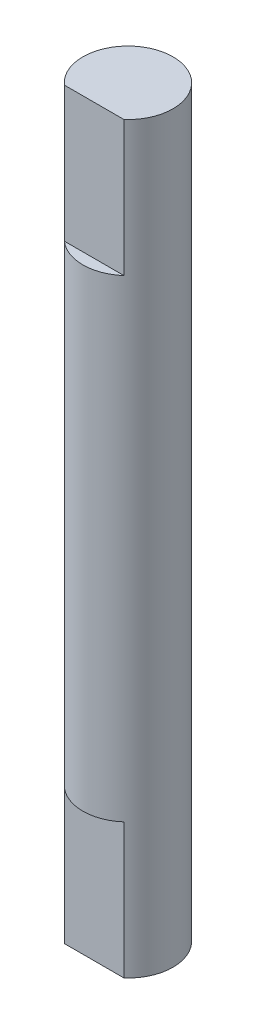
from build123d import *

# Parameters (mm, degrees)
SKETCH2_R               = 4
BOSS_EXTRUDE2_DEPTH     = 66
CUT_EXTRUDE1_START      = -12
CUT_EXTRUDE1_DEPTH      = 12
CUT_EXTRUDE3_DEPTH      = 67.241980647
CUT_EXTRUDE3_DEPTH_BACK = 12


with BuildPart() as part:
    # Sketch2 → Boss-Extrude2 (new body)
    with BuildSketch(Plane(origin=(0, 0, 0), x_dir=(1, 0, 0), z_dir=(0, 1, 0))):
        with Locations(Location((0, 0, 0), (0, 0, 270))):
            Circle(SKETCH2_R)
    extrude(amount=BOSS_EXTRUDE2_DEPTH)

    # Sketch3 → Cut-Extrude1 (cut)
    with BuildSketch(Plane(origin=(0, 66, 0), x_dir=(1, 0, 0), z_dir=(0, 1, 0)).offset(CUT_EXTRUDE1_START)):
        with BuildLine():
            Line((-2.645751311, -3), (2.645751311, -3))
            ThreePointArc((2.645751311, -3), (0, -4), (-2.645751311, -3))
        make_face()
    extrude(amount=CUT_EXTRUDE1_DEPTH, mode=Mode.SUBTRACT)

    # Sketch4 → Cut-Extrude3 (cut, two sides: drawn at the far end of the back side and taken through both)
    with BuildSketch(Plane.XZ.offset(-CUT_EXTRUDE3_DEPTH_BACK)):
        with BuildLine():
            ThreePointArc((2.645751311, 3), (0, 4), (-2.645751311, 3))
            Line((-2.645751311, 3), (2.645751311, 3))
        make_face()
    extrude(amount=CUT_EXTRUDE3_DEPTH + CUT_EXTRUDE3_DEPTH_BACK, mode=Mode.SUBTRACT)


solid = part.part
